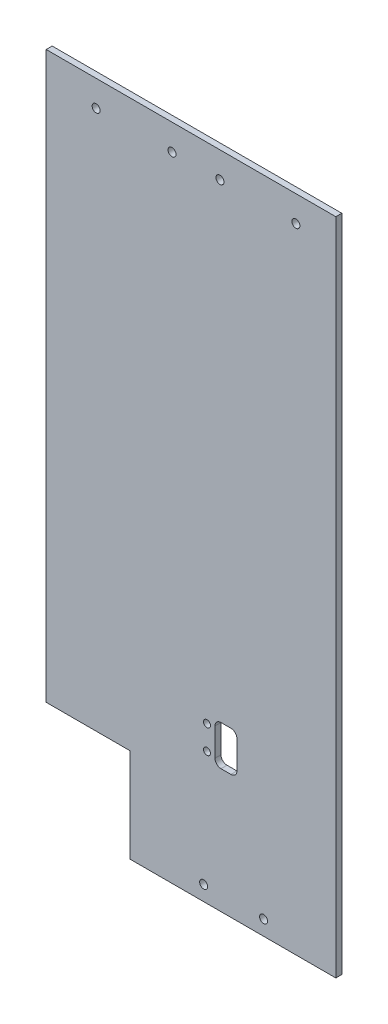
from build123d import *

# Parameters (mm, degrees)
ESQUISSE1_W             = 155
ESQUISSE1_H             = 330
BOSS_EXTRU_1_DEPTH      = 3
ENL_V_MAT_EXTRU_1_DEPTH = 10
ESQUISSE3_R             = 2
ENL_V_MAT_EXTRU_2_DEPTH = 10
ESQUISSE4_R             = 1.75
ENL_V_MAT_EXTRU_3_DEPTH = 10


with BuildPart() as part:
    # Esquisse1 → Boss.-Extru.1 (new body)
    with BuildSketch(Plane.XY):
        with Locations((39.953008068, 105.161286668)):
            Rectangle(ESQUISSE1_W, ESQUISSE1_H)
    extrude(amount=BOSS_EXTRU_1_DEPTH)

    # Esquisse2 → Enlèv. mat.-Extru.1 (cut)
    with BuildSketch(Plane.XY.offset(3)):
        Polygon((-27.546991932, -12.838713332), (-27.546991932, 270.161286668), (-37.546991932, 270.161286668), (-37.546991932, -12.838713332), (-37.546991932, -59.838713332), (14.453008068, -59.838713332), (14.453008068, -12.838713332), align=None)
    extrude(amount=-ENL_V_MAT_EXTRU_1_DEPTH, mode=Mode.SUBTRACT)

    # Esquisse3 → Enlèv. mat.-Extru.2 (cut)
    with BuildSketch(Plane.XY.offset(3)):
        with Locations((51.273516144, -52.338713332)):
            Circle(ESQUISSE3_R)
        with Locations((81.273516144, -52.338713332)):
            Circle(ESQUISSE3_R)
        with Locations((-2.546991932, 257.161286668)):
            Circle(ESQUISSE3_R)
        with Locations((35.453008068, 257.161286668)):
            Circle(ESQUISSE3_R)
        with Locations((59.453008068, 257.161286668)):
            Circle(ESQUISSE3_R)
        with Locations((97.453008068, 257.161286668)):
            Circle(ESQUISSE3_R)
    extrude(amount=-ENL_V_MAT_EXTRU_2_DEPTH, mode=Mode.SUBTRACT)

    # Esquisse4 → Enlèv. mat.-Extru.3 (cut)
    with BuildSketch(Plane.XY.offset(3)):
        with Locations((52.953008068, 18.161286668)):
            Circle(ESQUISSE4_R)
        with Locations((52.953008068, 6.161286668)):
            Circle(ESQUISSE4_R)
        with BuildLine():
            Line((56.953008068, 5.161286668), (56.953008068, 19.161286668))
            ThreePointArc((56.953008068, 19.161286668), (57.831687724, 21.282607011), (59.953008068, 22.161286668))
            Line((59.953008068, 22.161286668), (64.953008068, 22.161286668))
            ThreePointArc((64.953008068, 22.161286668), (67.074328411, 21.282607011), (67.953008068, 19.161286668))
            Line((67.953008068, 19.161286668), (67.953008068, 5.161286668))
            ThreePointArc((67.953008068, 5.161286668), (67.074328411, 3.039966324), (64.953008068, 2.161286668))
            Line((64.953008068, 2.161286668), (59.953008068, 2.161286668))
            ThreePointArc((59.953008068, 2.161286668), (57.831687724, 3.039966324), (56.953008068, 5.161286668))
        make_face()
    extrude(amount=-ENL_V_MAT_EXTRU_3_DEPTH, mode=Mode.SUBTRACT)


solid = part.part
